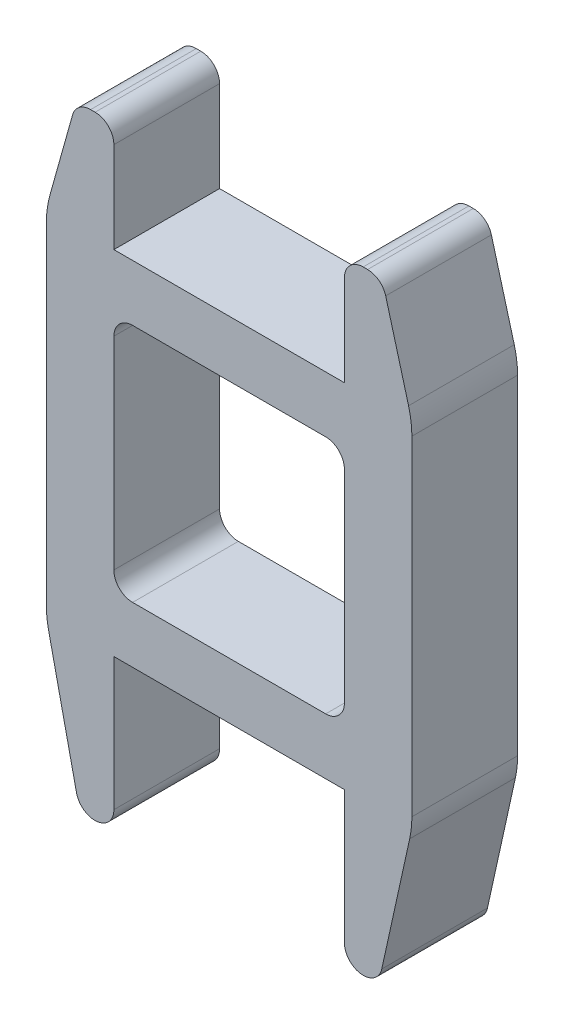
from build123d import *

# Parameters (mm, degrees)
BOSS_EXTRUDE1_DEPTH = 5.64


with BuildPart() as part:
    # Sketch1 → Boss-Extrude1 (new body)
    with BuildSketch(Plane.XY):
        with BuildLine():
            Line((1246.017783232, 971.126361431), (1246.259623553, 971.126361431))
            ThreePointArc((1246.259623553, 971.126361431), (1246.966730334, 970.833468212), (1247.259623553, 970.126361431))
            Line((1247.259623553, 970.126361431), (1247.259623553, 965.277195661))
            Line((1247.259623553, 965.277195661), (1259.559623553, 965.277195661))
            Line((1259.559623553, 965.277195661), (1259.559623553, 970.126361431))
            ThreePointArc((1259.559623553, 970.126361431), (1259.852516772, 970.833468212), (1260.559623553, 971.126361431))
            Line((1260.559623553, 971.126361431), (1260.796428716, 971.126361431))
            ThreePointArc((1260.796428716, 971.126361431), (1261.403120593, 970.921298514), (1261.760992458, 970.390211362))
            Line((1261.760992458, 970.390211362), (1262.982442266, 965.92492236))
            ThreePointArc((1262.982442266, 965.92492236), (1263.115130266, 965.271220008), (1263.159623553, 964.605672702))
            Line((1263.159623553, 964.605672702), (1263.159623553, 947.021688584))
            ThreePointArc((1263.159623553, 947.021688584), (1263.130237407, 946.480395771), (1263.042424389, 945.945465561))
            Line((1263.042424389, 945.945465561), (1261.551855255, 939.182785286))
            ThreePointArc((1261.551855255, 939.182785286), (1261.201695677, 938.618528574), (1260.575295088, 938.398029891))
            Line((1260.575295088, 938.398029891), (1260.559623553, 938.398029891))
            ThreePointArc((1260.559623553, 938.398029891), (1259.852516772, 938.69092311), (1259.559623553, 939.398029891))
            Line((1259.559623553, 939.398029891), (1259.559623553, 946.477195661))
            Line((1259.559623553, 946.477195661), (1247.259623553, 946.477195661))
            Line((1247.259623553, 946.477195661), (1247.259623553, 939.398029891))
            ThreePointArc((1247.259623553, 939.398029891), (1246.966730334, 938.69092311), (1246.259623553, 938.398029891))
            Line((1246.259623553, 938.398029891), (1246.243952018, 938.398029891))
            ThreePointArc((1246.243952018, 938.398029891), (1245.617551429, 938.618528574), (1245.267391851, 939.182785286))
            Line((1245.267391851, 939.182785286), (1243.776822717, 945.945465561))
            ThreePointArc((1243.776822717, 945.945465561), (1243.689009698, 946.480395771), (1243.659623553, 947.021688584))
            Line((1243.659623553, 947.021688584), (1243.659623553, 964.732702737))
            ThreePointArc((1243.659623553, 964.732702737), (1243.706264857, 965.414052599), (1243.845318606, 966.082690842))
            Line((1243.845318606, 966.082690842), (1245.054922243, 970.396359052))
            ThreePointArc((1245.054922243, 970.396359052), (1245.413629949, 970.923229557), (1246.017783232, 971.126361431))
        make_face()
        with BuildLine():
            Line((1247.259623553, 961.277195661), (1247.259623553, 950.477195661))
            ThreePointArc((1247.259623553, 950.477195661), (1247.552516772, 949.77008888), (1248.259623553, 949.477195661))
            Line((1248.259623553, 949.477195661), (1258.559623553, 949.477195661))
            ThreePointArc((1258.559623553, 949.477195661), (1259.266730334, 949.77008888), (1259.559623553, 950.477195661))
            Line((1259.559623553, 950.477195661), (1259.559623553, 961.277195661))
            ThreePointArc((1259.559623553, 961.277195661), (1259.266730334, 961.984302442), (1258.559623553, 962.277195661))
            Line((1258.559623553, 962.277195661), (1248.259623553, 962.277195661))
            ThreePointArc((1248.259623553, 962.277195661), (1247.552516772, 961.984302442), (1247.259623553, 961.277195661))
        make_face(mode=Mode.SUBTRACT)
    extrude(amount=BOSS_EXTRUDE1_DEPTH)


solid = part.part
